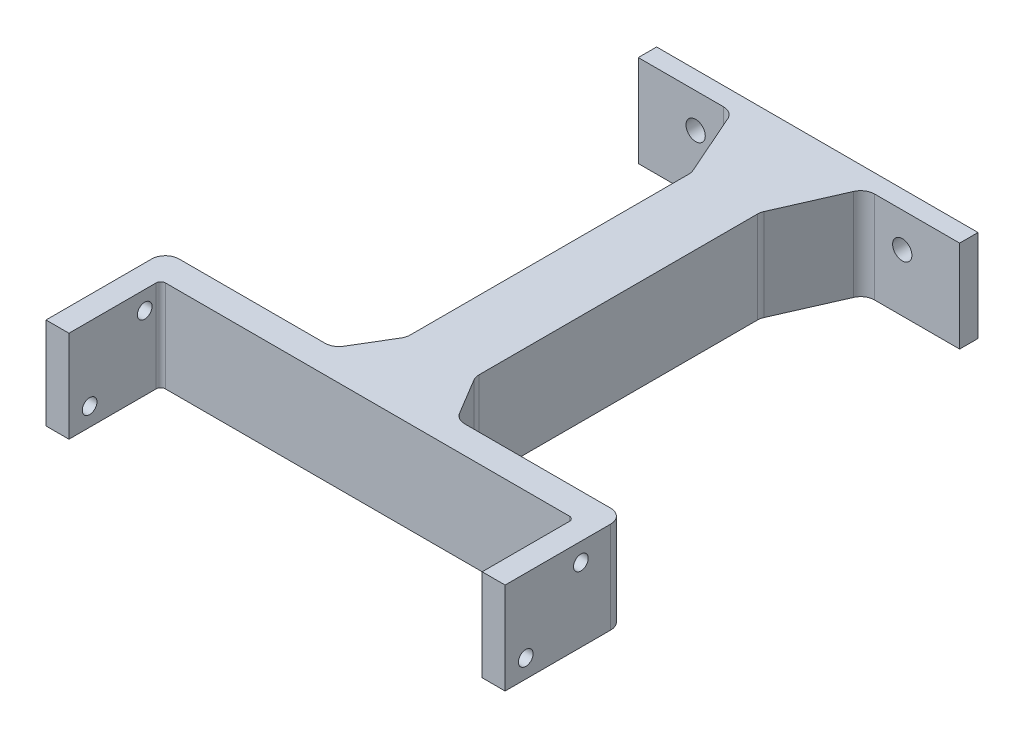
from build123d import *

# Parameters (mm, degrees)
SKETCH_1_W          = 70
SKETCH_1_H          = 20
EXTRUDE_1_DEPTH     = 4
SKETCH_2_R          = 2.1
CUT_EXTRUDE_1_DEPTH = 4
SKETCH_3_W          = 15
SKETCH_3_H          = 20
EXTRUDE_2_DEPTH     = 88
SKETCH_4_W          = 100
SKETCH_4_H          = 20
EXTRUDE_3_DEPTH     = 6
SKETCH_5_W          = 5
SKETCH_5_H          = 20
EXTRUDE_4_DEPTH     = 20
SKETCH_6_R          = 1.6
CUT_EXTRUDE_2_DEPTH = 95
CUT_EXTRUDE_START   = -20
SKETCH_6_2_R        = 1.6
CUT_EXTRUDE_3_DEPTH = 20
EXTRUDE_5_DEPTH     = 20
EXTRUDE_6_DEPTH     = 20
FILLET_1_R          = 3
FILLET_2_R          = 1


with BuildPart() as part:
    # 草图1 → 凸台-拉伸1 (new body)
    with BuildSketch(Plane.XY):
        with Locations((7.889344262, 6.686147681)):
            Rectangle(SKETCH_1_W, SKETCH_1_H)
    extrude(amount=EXTRUDE_1_DEPTH)

    # 草图2 → 切除-拉伸1 (cut)
    with BuildSketch(Plane.XY.offset(4)):
        with Locations((-14.610655738, 9.186147681)):
            Circle(SKETCH_2_R)
        with Locations((30.389344262, 9.186147681)):
            Circle(SKETCH_2_R)
    extrude(amount=-CUT_EXTRUDE_1_DEPTH, mode=Mode.SUBTRACT)

    # 草图3 → 凸台-拉伸2 (add)
    with BuildSketch(Plane.XY.offset(4)):
        with Locations((7.889344262, 6.686147681)):
            Rectangle(SKETCH_3_W, SKETCH_3_H)
    extrude(amount=EXTRUDE_2_DEPTH)

    # 草图4 → 凸台-拉伸3 (add)
    with BuildSketch(Plane.XY.offset(92)):
        with Locations((7.889344262, 6.686147681)):
            Rectangle(SKETCH_4_W, SKETCH_4_H)
    extrude(amount=EXTRUDE_3_DEPTH)

    # 草图5 → 凸台-拉伸4 (add)
    with BuildSketch(Plane.XY.offset(98)):
        with Locations((-39.610655738, 6.686147681)):
            Rectangle(SKETCH_5_W, SKETCH_5_H)
        with Locations((55.389344262, 6.686147681)):
            Rectangle(SKETCH_5_W, SKETCH_5_H)
    extrude(amount=EXTRUDE_4_DEPTH)

    # 草图6 → 切除-拉伸2 (cut)
    with BuildSketch(Plane(origin=(-37.110655738, 0, 0), x_dir=(0, 0, -1), z_dir=(1, 0, 0))):
        with Locations(Location((-101.5, 12.686147681, 0), (0, 0, 180))):
            Circle(SKETCH_6_R)
        with Locations(Location((-113.5, 0.686147681, 0), (0, 0, 180))):
            Circle(SKETCH_6_R)
    extrude(amount=CUT_EXTRUDE_2_DEPTH, mode=Mode.SUBTRACT)

    # 草图6<2> → 切除-拉伸3 (cut)
    with BuildSketch(Plane(origin=(-37.110655738, 0, 0), x_dir=(0, 0, -1), z_dir=(1, 0, 0)).offset(CUT_EXTRUDE_START)):
        with Locations(Location((-101.5, 12.686147681, 0), (0, 0, 180))):
            Circle(SKETCH_6_2_R)
        with Locations(Location((-113.5, 0.686147681, 0), (0, 0, 180))):
            Circle(SKETCH_6_2_R)
    extrude(amount=CUT_EXTRUDE_3_DEPTH, mode=Mode.SUBTRACT)

    # 草图7 → 凸台-拉伸5 (add)
    with BuildSketch(Plane.XZ.offset(3.313852319)):
        Polygon((0.389344262, 4), (0.389344262, 19.90041694), (-6.610655738, 4), align=None)
        Polygon((15.389344262, 4), (22.389344262, 4), (15.389344262, 19.90041694), align=None)
    extrude(amount=-EXTRUDE_5_DEPTH)

    # 草图8 → 凸台-拉伸6 (add)
    with BuildSketch(Plane.XZ.offset(3.313852319)):
        Polygon((-5.610655738, 92), (0.389344262, 82), (0.389344262, 92), align=None)
        Polygon((15.389344262, 82), (15.389344262, 92), (21.389344262, 92), align=None)
    extrude(amount=-EXTRUDE_6_DEPTH)

    # 圆角1
    fillet_1_edges = [part.edges().sort_by_distance(p)[0] for p in [
        (-6.610655738, 6.686147681, 4),
        (0.389344262, 6.686147681, 19.90041694),
        (15.389344262, 6.686147681, 19.90041694),
        (22.389344262, 6.686147681, 4),
        (-5.610655738, 6.686147681, 92),
        (0.389344262, 6.686147681, 82),
        (21.389344262, 6.686147681, 92),
        (15.389344262, 6.686147681, 82),
        (-42.110655738, 6.686147681, 92),
        (57.889344262, 6.686147681, 92),
    ]]
    fillet(fillet_1_edges, radius=FILLET_1_R)

    # 圆角2
    fillet_2_edges = [part.edges().sort_by_distance(p)[0] for p in [
        (-37.110655738, 6.686147681, 98),
        (52.889344262, 6.686147681, 98),
    ]]
    fillet(fillet_2_edges, radius=FILLET_2_R)


solid = part.part
